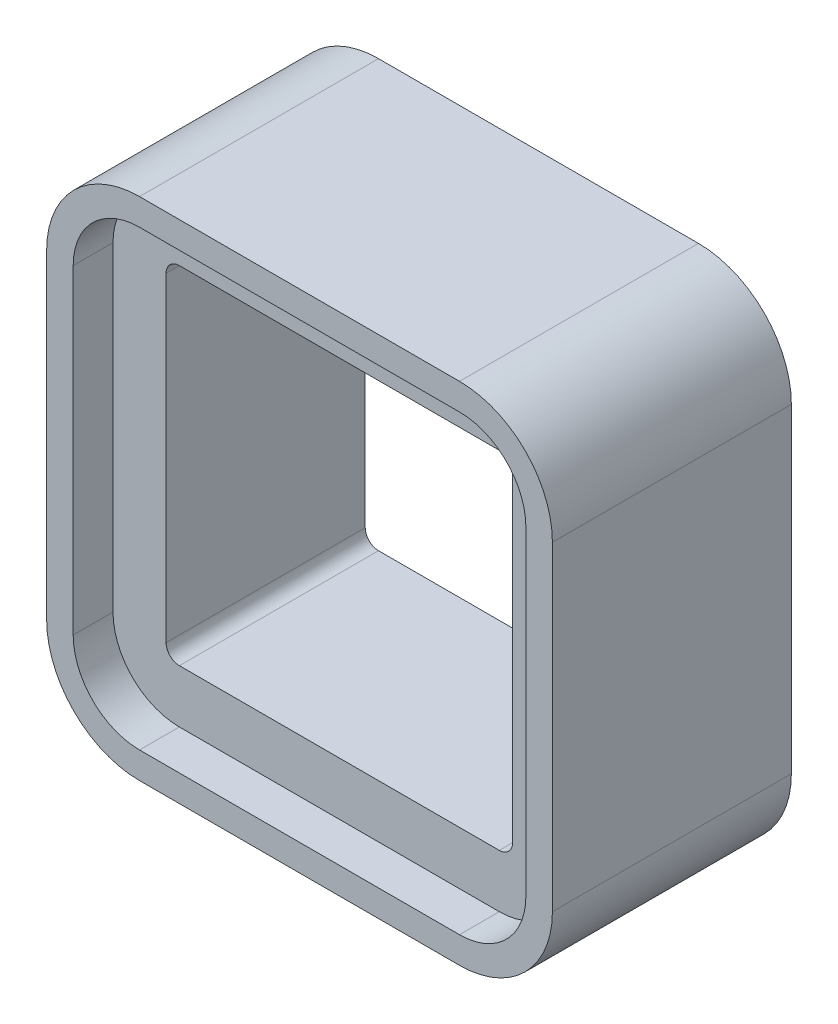
from build123d import *

# Parameters (mm, degrees)
SKIZZE1_W                       = 38.1
SKIZZE1_H                       = 38.1
SKIZZE1_W_2                     = 34.1
SKIZZE1_H_2                     = 34.1
AUFSATZ_LINEAR_AUSTRAGEN1_DEPTH = 3
SKIZZE2_W                       = 38.1
SKIZZE2_H                       = 38.1
AUFSATZ_LINEAR_AUSTRAGEN2_DEPTH = 15
VERRUNDUNG1_R                   = 5
VERRUNDUNG2_R                   = 7
SCHNITT_LINEAR_AUSTRAGEN1_DEPTH = 15


with BuildPart() as part:
    # Skizze1 → Aufsatz-Linear austragen1 (new body)
    with BuildSketch(Plane.XY):
        Rectangle(SKIZZE1_W, SKIZZE1_H)
        Rectangle(SKIZZE1_W_2, SKIZZE1_H_2, mode=Mode.SUBTRACT)
    extrude(amount=AUFSATZ_LINEAR_AUSTRAGEN1_DEPTH)

    # Skizze2 → Aufsatz-Linear austragen2 (add)
    with BuildSketch(Plane(origin=(0, 0, 0), x_dir=(-1, 0, 0), z_dir=(0, 0, -1))):
        Rectangle(SKIZZE2_W, SKIZZE2_H)
    extrude(amount=AUFSATZ_LINEAR_AUSTRAGEN2_DEPTH)

    # Verrundung1
    verrundung1_edges = [part.edges().sort_by_distance(p)[0] for p in [
        (-17.05, 17.05, 1.5),
        (-17.05, -17.05, 1.5),
        (17.05, -17.05, 1.5),
        (17.05, 17.05, 1.5),
    ]]
    fillet(verrundung1_edges, radius=VERRUNDUNG1_R)

    # Verrundung2
    verrundung2_edges = [part.edges().sort_by_distance(p)[0] for p in [
        (-19.05, 19.05, -6),
        (19.05, 19.05, -6),
        (19.05, -19.05, -6),
        (-19.05, -19.05, -6),
    ]]
    fillet(verrundung2_edges, radius=VERRUNDUNG2_R)

    # Skizze3 → Schnitt-Linear austragen1 (cut)
    with BuildSketch(Plane.XY):
        with BuildLine():
            Line((-13.05, 12.05), (-13.05, -12.05))
            ThreePointArc((-13.05, -12.05), (-12.757106781, -12.757106781), (-12.05, -13.05))
            Line((-12.05, -13.05), (12.05, -13.05))
            ThreePointArc((12.05, -13.05), (12.757106781, -12.757106781), (13.05, -12.05))
            Line((13.05, -12.05), (13.05, 12.05))
            ThreePointArc((13.05, 12.05), (12.757106781, 12.757106781), (12.05, 13.05))
            Line((12.05, 13.05), (-12.05, 13.05))
            ThreePointArc((-12.05, 13.05), (-12.757106781, 12.757106781), (-13.05, 12.05))
        make_face()
    extrude(amount=-SCHNITT_LINEAR_AUSTRAGEN1_DEPTH, mode=Mode.SUBTRACT)


solid = part.part
